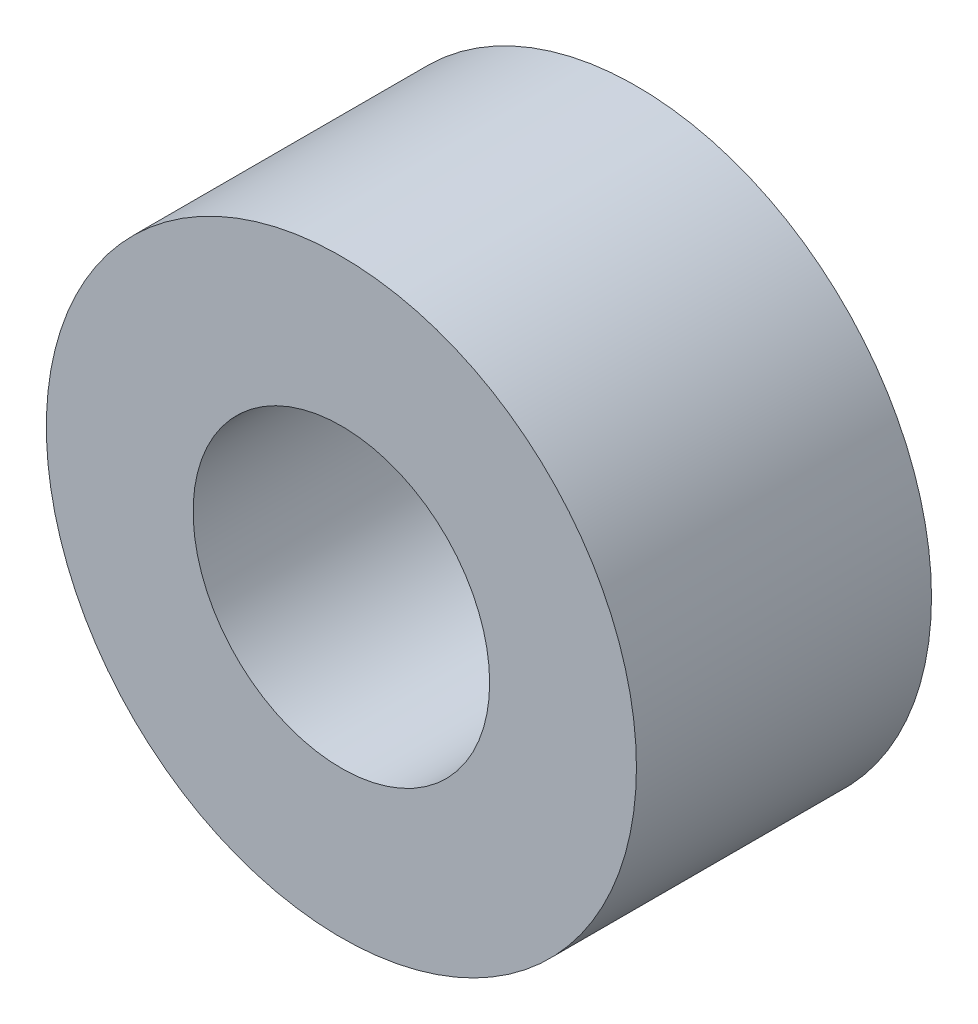
from build123d import *

# Parameters (mm, degrees)
SKETCH1_R           = 10
BOSS_EXTRUDE1_DEPTH = 10
SKETCH2_R           = 5.025
CUT_EXTRUDE1_DEPTH  = 10


with BuildPart() as part:
    # Sketch1 → Boss-Extrude1 (new body)
    with BuildSketch(Plane.XY):
        Circle(SKETCH1_R)
    extrude(amount=BOSS_EXTRUDE1_DEPTH)

    # Sketch2 → Cut-Extrude1 (cut)
    with BuildSketch(Plane.XY.offset(10)):
        Circle(SKETCH2_R)
    extrude(amount=-CUT_EXTRUDE1_DEPTH, mode=Mode.SUBTRACT)


solid = part.part
